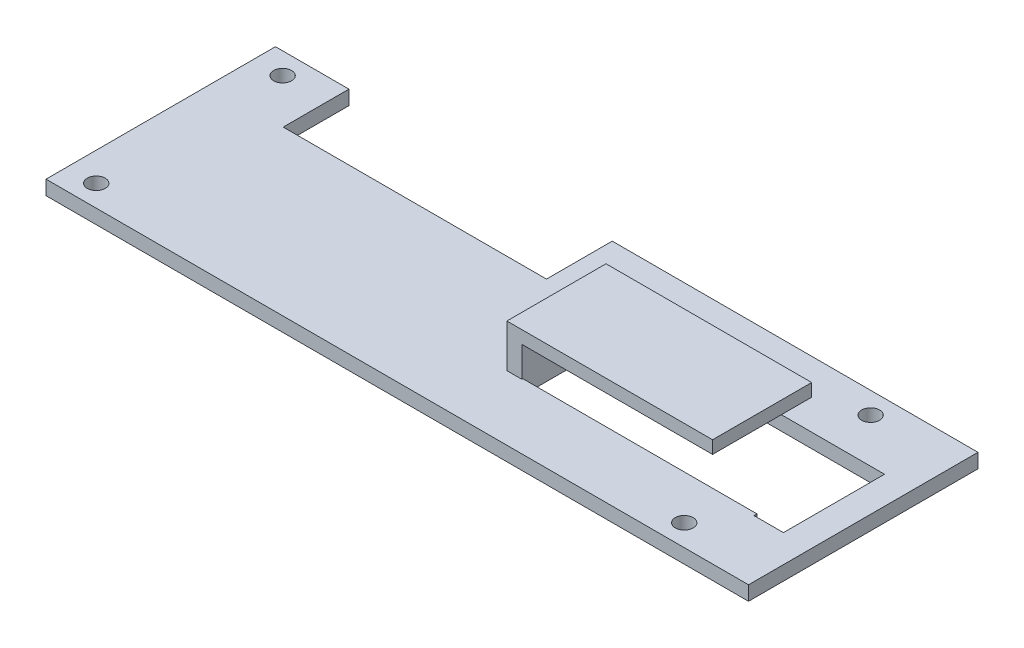
from build123d import *

# Parameters (mm, degrees)
SKETCH1_W           = 114.3
SKETCH1_H           = 40.64
BOSS_EXTRUDE1_DEPTH = 2.54
SKETCH2_R           = 1.5875
CUT_EXTRUDE2_DEPTH  = 61.708125486
SKETCH3_W           = 43.201910461
SKETCH3_H           = 17.373570515
SKETCH3_W_2         = 46.628586193
SKETCH3_H_2         = 22.401940477
CUT_EXTRUDE3_DEPTH  = 61.708125486
SKETCH4_W           = 2.643760601
SKETCH4_H           = 17.553517305
BOSS_EXTRUDE2_DEPTH = 7.62
SKETCH5_W           = 17.553517305
SKETCH5_H           = 2.255880329
BOSS_EXTRUDE3_DEPTH = 33.782
BOSS_EXTRUDE4_DEPTH = 2.54


with BuildPart() as part:
    # Sketch1 → Boss-Extrude1 (new body)
    with BuildSketch(Plane(origin=(0, 0, 0), x_dir=(1, 0, 0), z_dir=(0, 1, 0))):
        Rectangle(SKETCH1_W, SKETCH1_H)
    extrude(amount=BOSS_EXTRUDE1_DEPTH)

    # Sketch2 → Cut-Extrude2 (cut, through all)
    with BuildSketch(Plane(origin=(0, 2.54, 0), x_dir=(1, 0, 0), z_dir=(0, 1, 0))):
        with Locations(Location((-52.07, 16.51, 0), (0, 0, 270))):
            Circle(SKETCH2_R)
        with Locations(Location((52.07, 16.51, 0), (0, 0, 270))):
            Circle(SKETCH2_R)
        with Locations(Location((52.07, -16.51, 0), (0, 0, 270))):
            Circle(SKETCH2_R)
        with Locations(Location((-52.07, -16.51, 0), (0, 0, 270))):
            Circle(SKETCH2_R)
    extrude(amount=-CUT_EXTRUDE2_DEPTH, mode=Mode.SUBTRACT)

    # Sketch3 → Cut-Extrude3 (cut, through all)
    with BuildSketch(Plane(origin=(0, 2.54, 0), x_dir=(1, 0, 0), z_dir=(0, 1, 0))):
        with Locations((37.284400117, -0.013259404)):
            Rectangle(SKETCH3_W, SKETCH3_H)
        with Locations((-20.818521539, 19.874496091)):
            Rectangle(SKETCH3_W_2, SKETCH3_H_2)
    extrude(amount=-CUT_EXTRUDE3_DEPTH, mode=Mode.SUBTRACT)

    # Sketch4 → Boss-Extrude2 (add)
    with BuildSketch(Plane(origin=(0, 2.54, 0), x_dir=(1, 0, 0), z_dir=(0, 1, 0))):
        with Locations((14.361564587, -0.103232799)):
            Rectangle(SKETCH4_W, SKETCH4_H)
    extrude(amount=BOSS_EXTRUDE2_DEPTH)

    # Sketch5 → Boss-Extrude3 (add)
    with BuildSketch(Plane(origin=(15.683444887, 0, 0), x_dir=(0, 0, -1), z_dir=(1, 0, 0))):
        with Locations((-0.103232799, 9.032059836)):
            Rectangle(SKETCH5_W, SKETCH5_H)
    extrude(amount=BOSS_EXTRUDE3_DEPTH)

    # Sketch6 → Boss-Extrude4 (add)
    with BuildSketch(Plane(origin=(0, 2.54, 0), x_dir=(1, 0, 0), z_dir=(0, 1, 0))):
        Polygon((57.15, 20.32), (57.15, 8.673525853), (62.36601956, 8.673525853), (62.36601956, -9.230657654), (57.15, -9.230657654), (57.15, -20.32), (67.276494875, -20.32), (67.276494875, 20.32), align=None)
    extrude(amount=-BOSS_EXTRUDE4_DEPTH)


solid = part.part
